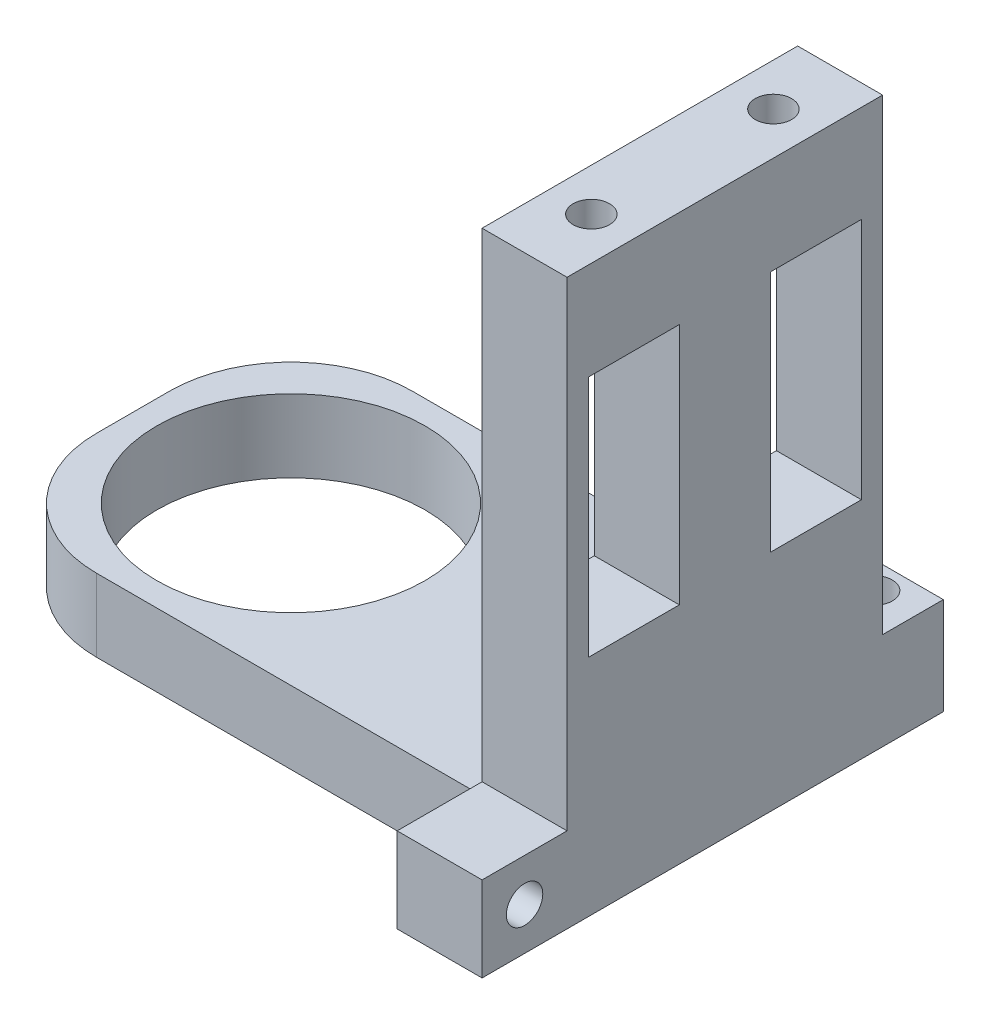
from build123d import *

# Parameters (mm, degrees)
SKETCH_1_W                = 38
SKETCH_1_H                = 46.5
EXTRUDE_1_DEPTH           = 7
SKETCH_2_W                = 5
SKETCH_2_H                = 38.5
CUT_EXTRUDE_1_DEPTH       = 52.100391388
SKETCH_3_W                = 7
SKETCH_3_H                = 39.5
CUT_EXTRUDE_2_DEPTH       = 52.100391388
SKETCH_4_W                = 7.5
SKETCH_4_H                = 20
CUT_EXTRUDE_3_DEPTH       = 52.100391388
SKETCH_5_W                = 7.5
SKETCH_5_H                = 20
CUT_EXTRUDE_4_DEPTH       = 52.100391388
SKETCH_6_W                = 26
SKETCH_6_H                = 6
EXTRUDE_2_DEPTH           = 41.75
HOLE_WIZARD_3_0_3_1_D     = 3
HOLE_WIZARD_3_0_3_1_DEPTH = 8
HOLE_WIZARD_3_0_3_2_D     = 3
HOLE_WIZARD_3_0_3_2_DEPTH = 48.75
HOLE_WIZARD_3_0_3_3_D     = 3
HOLE_WIZARD_M201_D        = 22.1
HOLE_WIZARD_M201_DEPTH    = 46.5
FILLET_1_R                = 10


with BuildPart() as part:
    # Эскиз1 → Бобышка-Вытянуть1 (new body)
    with BuildSketch(Plane(origin=(24.375, 0, 0), x_dir=(0, 0, -1), z_dir=(1, 0, 0))):
        with Locations((-1, 23.25)):
            Rectangle(SKETCH_1_W, SKETCH_1_H)
    extrude(amount=-EXTRUDE_1_DEPTH)

    # Эскиз2 → Вырез-Вытянуть1 (cut, through all)
    with BuildSketch(Plane.ZY.offset(-17.375)):
        with Locations((-15.5, 27.25)):
            Rectangle(SKETCH_2_W, SKETCH_2_H)
    extrude(amount=-CUT_EXTRUDE_1_DEPTH, mode=Mode.SUBTRACT)

    # Эскиз3 → Вырез-Вытянуть2 (cut, through all)
    with BuildSketch(Plane.ZY.offset(-17.375)):
        with Locations((16.5, 26.75)):
            Rectangle(SKETCH_3_W, SKETCH_3_H)
    extrude(amount=-CUT_EXTRUDE_2_DEPTH, mode=Mode.SUBTRACT)

    # Эскиз4 → Вырез-Вытянуть3 (cut, through all)
    with BuildSketch(Plane(origin=(24.375, 0, 0), x_dir=(0, 0, -1), z_dir=(1, 0, 0))):
        with Locations((-7.5, 28.5)):
            Rectangle(SKETCH_4_W, SKETCH_4_H)
    extrude(amount=-CUT_EXTRUDE_3_DEPTH, mode=Mode.SUBTRACT)

    # Эскиз5 → Вырез-Вытянуть4 (cut, through all)
    with BuildSketch(Plane.ZY.offset(-17.375)):
        with Locations((-7.5, 28.5)):
            Rectangle(SKETCH_5_W, SKETCH_5_H)
    extrude(amount=-CUT_EXTRUDE_4_DEPTH, mode=Mode.SUBTRACT)

    # Эскиз6 → Бобышка-Вытянуть2 (add)
    with BuildSketch(Plane.ZY.offset(-17.375)):
        with Locations((0, 3)):
            Rectangle(SKETCH_6_W, SKETCH_6_H)
    extrude(amount=EXTRUDE_2_DEPTH)

    # Диаметр отверстия Ø3.0 (3)1
    with Locations(Plane(origin=(0, 46.5, 0), x_dir=(1, 0, 0), z_dir=(0, 1, 0))):
        with Locations((20.875, -7.5), (20.875, 7.5)):
            Hole(HOLE_WIZARD_3_0_3_1_D / 2, depth=HOLE_WIZARD_3_0_3_1_DEPTH)

    # Диаметр отверстия Ø3.0 (3)2
    with Locations(Plane(origin=(24.375, 0, 0), x_dir=(0, 0, -1), z_dir=(1, 0, 0))):
        with Locations((-16.5, 3.5)):
            Hole(HOLE_WIZARD_3_0_3_2_D / 2, depth=HOLE_WIZARD_3_0_3_2_DEPTH)

    # Диаметр отверстия Ø3.0 (3)3 (through all)
    with Locations(Plane(origin=(0, 8, 0), x_dir=(1, 0, 0), z_dir=(0, 1, 0))):
        with Locations((20.875, 15.8)):
            Hole(HOLE_WIZARD_3_0_3_3_D / 2)

    # Отверстие с зазором M201
    with Locations(Plane(origin=(0, 0, 0), x_dir=(-1, 0, 0), z_dir=(0, -1, 0))):
        with Locations((11.375, 0)):
            Hole(HOLE_WIZARD_M201_D / 2, depth=HOLE_WIZARD_M201_DEPTH)

    # Скругление1
    fillet_1_edges = [part.edges().sort_by_distance(p)[0] for p in [
        (-24.375, 3, -13),
        (-24.375, 3, 13),
    ]]
    fillet(fillet_1_edges, radius=FILLET_1_R)


solid = part.part
